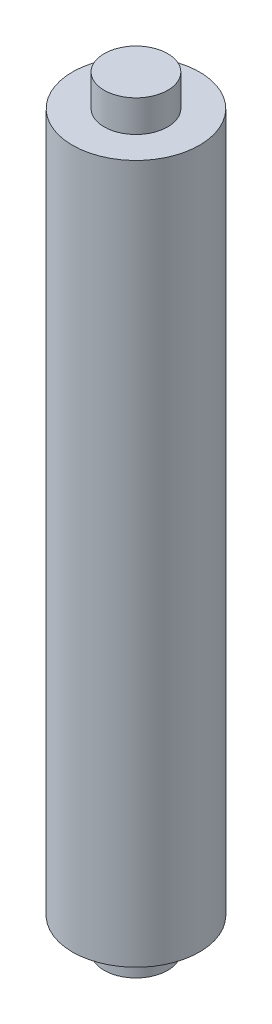
from build123d import *

# Parameters (mm, degrees)
SKETCH2_R           = 10
SKETCH2_R_2         = 5
BOSS_EXTRUDE1_DEPTH = 110
SKETCH2_2_R         = 5
BOSS_EXTRUDE2_DEPTH = 115
BOSS_EXTRUDE3_START = -5
SKETCH2_3_R         = 5
BOSS_EXTRUDE3_DEPTH = 5


with BuildPart() as part:
    # Sketch2 → Boss-Extrude1 (new body)
    with BuildSketch(Plane(origin=(0, 0, 0), x_dir=(1, 0, 0), z_dir=(0, 1, 0))):
        Circle(SKETCH2_R)
        Circle(SKETCH2_R_2, mode=Mode.SUBTRACT)
    extrude(amount=BOSS_EXTRUDE1_DEPTH)

    # Sketch2<2> → Boss-Extrude2 (add)
    with BuildSketch(Plane(origin=(0, 0, 0), x_dir=(1, 0, 0), z_dir=(0, 1, 0))):
        Circle(SKETCH2_2_R)
    extrude(amount=BOSS_EXTRUDE2_DEPTH)

    # Sketch2<3> → Boss-Extrude3 (add)
    with BuildSketch(Plane(origin=(0, 0, 0), x_dir=(1, 0, 0), z_dir=(0, 1, 0)).offset(BOSS_EXTRUDE3_START)):
        Circle(SKETCH2_3_R)
    extrude(amount=BOSS_EXTRUDE3_DEPTH)


solid = part.part
